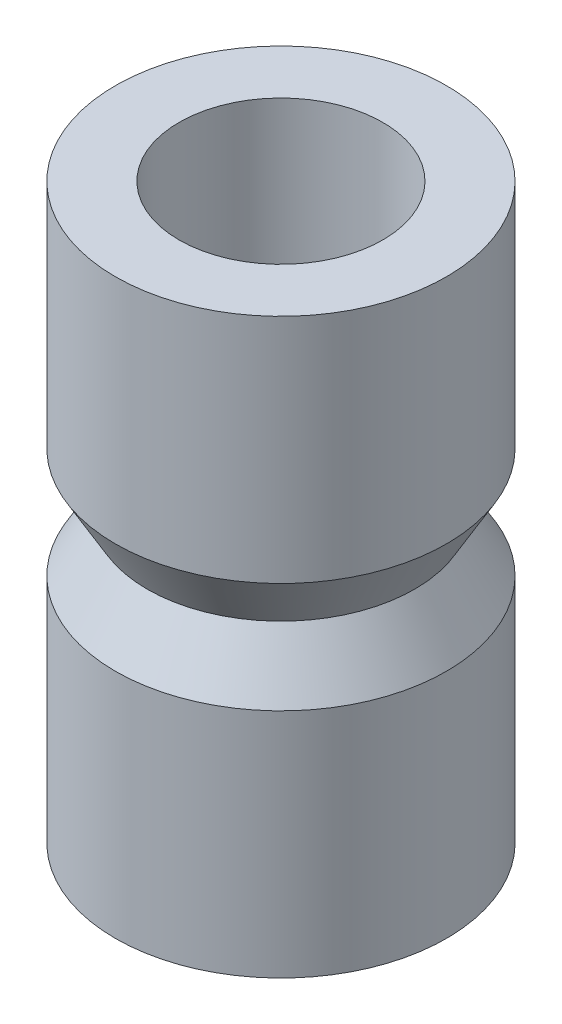
from build123d import *

# Parameters (mm, degrees)
SKETCH_1_R      = 2.6
SKETCH_1_R_2    = 1.6
EXTRUDE_1_DEPTH = 9


with BuildPart() as part:
    # 草图1 → 凸台-拉伸1 (new body)
    with BuildSketch(Plane(origin=(0, 0, 0), x_dir=(1, 0, 0), z_dir=(0, 1, 0))):
        with Locations(Location((0, 0, 0), (0, 0, 270))):
            Circle(SKETCH_1_R)
        with Locations(Location((0, 0, 0), (0, 0, 270))):
            Circle(SKETCH_1_R_2, mode=Mode.SUBTRACT)
    extrude(amount=EXTRUDE_1_DEPTH)

    # 草图2 → 切除-旋转1 (revolve, cut)
    with BuildSketch(Plane.XY, mode=Mode.PRIVATE) as cut_revolve_1_sk:
        Polygon((-2.6, 5.366025404), (-2.1, 4.5), (-2.6, 3.633974596), align=None)
    revolve(cut_revolve_1_sk.sketch.rotate(Axis((0, 9, 0), (0, -1, 0)), 270), axis=Axis((0, 9, 0), (0, -1, 0)), mode=Mode.SUBTRACT)


solid = part.part
